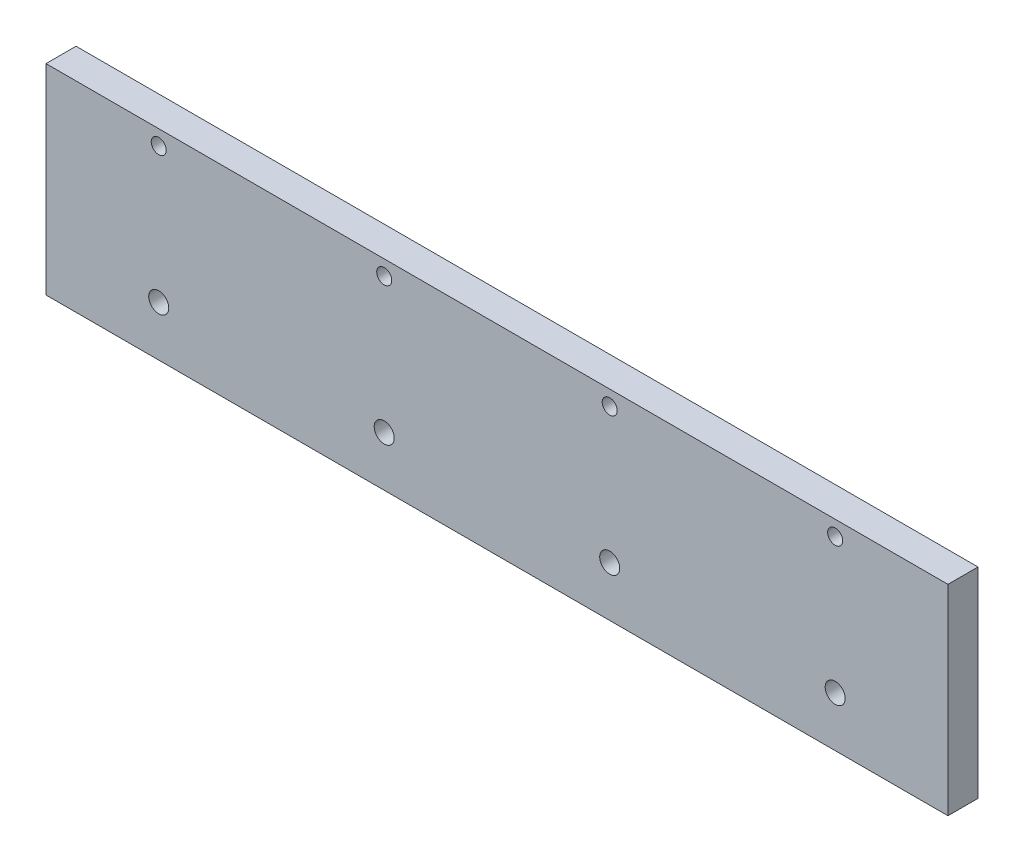
from build123d import *

# Parameters (mm, degrees)
SKETCH1_W           = 360
SKETCH1_H           = 80
BOSS_EXTRUDE1_DEPTH = 12
CUT_EXTRUDE1_REACH  = 186.781
SKETCH2_R           = 3
SKETCH2_R_2         = 4
LPATTERN1_COUNT     = 4
LPATTERN1_PITCH     = 90


with BuildPart() as part:
    # Sketch1 → Boss-Extrude1 (new body)
    with BuildSketch(Plane.XY):
        Rectangle(SKETCH1_W, SKETCH1_H)
    extrude(amount=BOSS_EXTRUDE1_DEPTH)

    # Sketch2 → Cut-Extrude1 (cut, up to next)
    with BuildSketch(Plane.XY.offset(12), mode=Mode.PRIVATE) as cut_extrude1_sk1:
        with Locations((-135, 34)):
            Circle(SKETCH2_R)
    cut_extrude1_tool1 = extrude(cut_extrude1_sk1.sketch, amount=-CUT_EXTRUDE1_REACH, mode=Mode.PRIVATE) & part.part
    # Sketch2 → Cut-Extrude1 (cut, up to next)
    with BuildSketch(Plane.XY.offset(12), mode=Mode.PRIVATE) as cut_extrude1_sk2:
        with Locations((-135, -20)):
            Circle(SKETCH2_R_2)
    cut_extrude1_tool2 = extrude(cut_extrude1_sk2.sketch, amount=-CUT_EXTRUDE1_REACH, mode=Mode.PRIVATE) & part.part
    cut_extrude1_1 = cut_extrude1_tool1.solids().sort_by_distance((-135, 34, 12))[0]
    add(cut_extrude1_1, mode=Mode.SUBTRACT)
    cut_extrude1_2 = cut_extrude1_tool2.solids().sort_by_distance((-135, -20, 12))[0]
    add(cut_extrude1_2, mode=Mode.SUBTRACT)
    cut_extrude1 = cut_extrude1_1 + cut_extrude1_2  # Cut-Extrude1 as one shape, for the pattern or mirror that repeats it

    # LPattern1: Cut-Extrude1 ×4
    with Locations(*[(i * LPATTERN1_PITCH, 0, 0) for i in range(1, LPATTERN1_COUNT)]):
        add(cut_extrude1, mode=Mode.SUBTRACT)


solid = part.part
